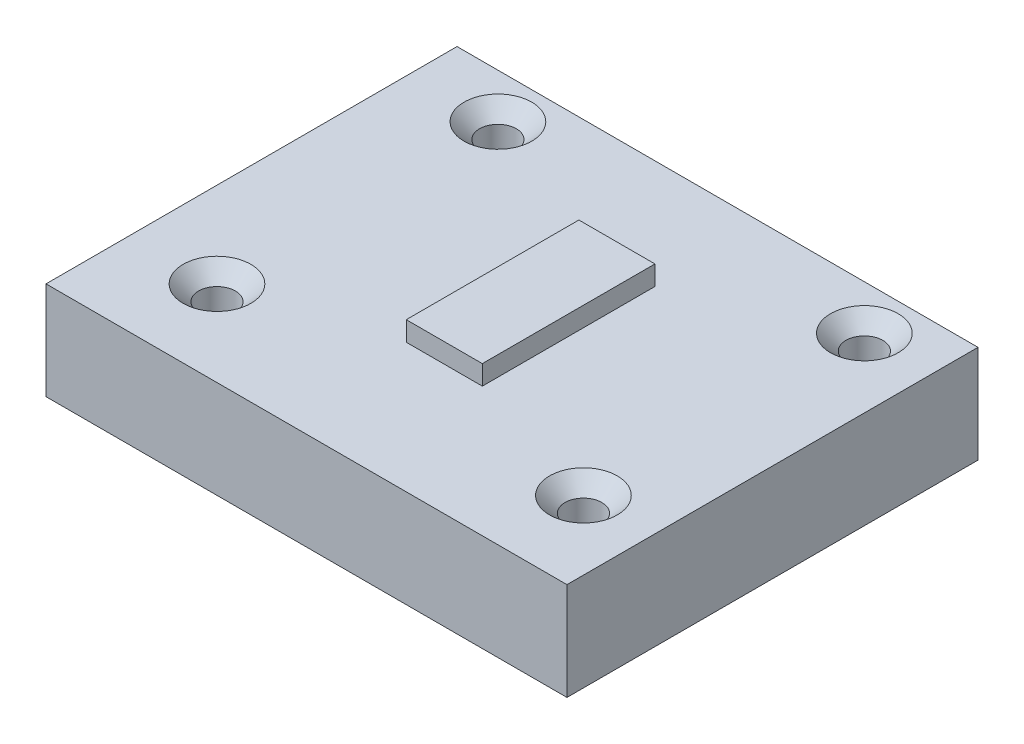
from build123d import *

# Parameters (mm, degrees)
SKETCH1_W                                       = 203.2
SKETCH1_H                                       = 107.15625
BOSS_EXTRUDE1_DEPTH                             = 6.35
CSK_FOR_M2_FLAT_HEAD_MACHINE_SCREW1_D           = 2.4
CSK_FOR_M2_FLAT_HEAD_MACHINE_SCREW1_CSINK_D     = 4.4
CSK_FOR_M2_FLAT_HEAD_MACHINE_SCREW1_CSINK_ANGLE = 90
SKETCH4_W                                       = 4.943628295
SKETCH4_H                                       = 11.218233438
BOSS_EXTRUDE2_DEPTH                             = 1.27
SKETCH5_R                                       = 2.2
SKETCH5_W                                       = 33.85522898
SKETCH5_H                                       = 80.444626197
CUT_EXTRUDE1_DEPTH                              = 230.810844857


with BuildPart() as part:
    # Sketch1 → Boss-Extrude1 (new body)
    with BuildSketch(Plane(origin=(0, 0, 0), x_dir=(1, 0, 0), z_dir=(0, 1, 0))):
        with Locations((101.6, 53.578125)):
            Rectangle(SKETCH1_W, SKETCH1_H)
    extrude(amount=BOSS_EXTRUDE1_DEPTH)

    # CSK for M2 Flat Head Machine Screw1 (through all)
    with Locations(Plane(origin=(0, 6.35, 0), x_dir=(1, 0, 0), z_dir=(0, 1, 0))):
        with Locations((5.55625, 101.6), (1.201469153, 116.400099152), (1.201469153, 113.370035287), (29.36875, 101.6), (5.55625, 5.55625), (29.36875, 5.55625), (173.83125, 5.55625), (173.83125, 101.6), (197.64375, 101.6), (197.64375, 5.55625), (5.55625, 83.34375), (29.36875, 83.34375), (5.55625, 23.8125), (173.83125, 83.34375), (197.64375, 83.34375), (173.83125, 23.8125), (197.64375, 23.8125), (29.36875, 23.8125)):
            CounterSinkHole(CSK_FOR_M2_FLAT_HEAD_MACHINE_SCREW1_D / 2, CSK_FOR_M2_FLAT_HEAD_MACHINE_SCREW1_CSINK_D / 2, counter_sink_angle=CSK_FOR_M2_FLAT_HEAD_MACHINE_SCREW1_CSINK_ANGLE)

    # Sketch4 → Boss-Extrude2 (add)
    with BuildSketch(Plane(origin=(0, 6.35, 0), x_dir=(1, 0, 0), z_dir=(0, 1, 0))):
        with Locations((17.463249219, 14.029098644)):
            Rectangle(SKETCH4_W, SKETCH4_H)
    extrude(amount=BOSS_EXTRUDE2_DEPTH)

    # Sketch5 → Cut-Extrude1 (cut, through all)
    # profile 1 of 14: a face of its own
    with BuildSketch(Plane(origin=(0, 6.35, 0), x_dir=(1, 0, 0), z_dir=(0, 1, 0))):
        Polygon((203.2, 107.15625), (33.85522898, 107.15625), (33.85522898, 26.711623803), (33.85522898, 0), (203.2, 0), align=None)
        with Locations((173.83125, 5.55625)):
            Circle(SKETCH5_R, mode=Mode.SUBTRACT)
        with Locations((197.64375, 5.55625)):
            Circle(SKETCH5_R, mode=Mode.SUBTRACT)
        with Locations((173.83125, 23.8125)):
            Circle(SKETCH5_R, mode=Mode.SUBTRACT)
        with Locations((197.64375, 23.8125)):
            Circle(SKETCH5_R, mode=Mode.SUBTRACT)
        with Locations((173.83125, 83.34375)):
            Circle(SKETCH5_R, mode=Mode.SUBTRACT)
        with Locations((197.64375, 83.34375)):
            Circle(SKETCH5_R, mode=Mode.SUBTRACT)
        with Locations((173.83125, 101.6)):
            Circle(SKETCH5_R, mode=Mode.SUBTRACT)
        with Locations((197.64375, 101.6)):
            Circle(SKETCH5_R, mode=Mode.SUBTRACT)
    # profile 2 of 14: a face of its own
    with BuildSketch(Plane(origin=(0, 6.35, 0), x_dir=(1, 0, 0), z_dir=(0, 1, 0))):
        with Locations((16.92761449, 66.933936902)):
            Rectangle(SKETCH5_W, SKETCH5_H)
        with Locations((5.55625, 83.34375)):
            Circle(SKETCH5_R, mode=Mode.SUBTRACT)
        with Locations((29.36875, 83.34375)):
            Circle(SKETCH5_R, mode=Mode.SUBTRACT)
        with Locations((5.55625, 101.6)):
            Circle(SKETCH5_R, mode=Mode.SUBTRACT)
        with Locations((29.36875, 101.6)):
            Circle(SKETCH5_R, mode=Mode.SUBTRACT)
    # profile 3 of 14: a face of its own
    with BuildSketch(Plane(origin=(0, 6.35, 0), x_dir=(1, 0, 0), z_dir=(0, 1, 0))):
        with Locations((5.55625, 83.34375)):
            Circle(SKETCH5_R)
    # profile 4 of 14: a face of its own
    with BuildSketch(Plane(origin=(0, 6.35, 0), x_dir=(1, 0, 0), z_dir=(0, 1, 0))):
        with Locations((5.55625, 101.6)):
            Circle(SKETCH5_R)
    # profile 5 of 14: a face of its own
    with BuildSketch(Plane(origin=(0, 6.35, 0), x_dir=(1, 0, 0), z_dir=(0, 1, 0))):
        with Locations((29.36875, 101.6)):
            Circle(SKETCH5_R)
    # profile 6 of 14: a face of its own
    with BuildSketch(Plane(origin=(0, 6.35, 0), x_dir=(1, 0, 0), z_dir=(0, 1, 0))):
        with Locations((29.36875, 83.34375)):
            Circle(SKETCH5_R)
    # profile 7 of 14: a face of its own
    with BuildSketch(Plane(origin=(0, 6.35, 0), x_dir=(1, 0, 0), z_dir=(0, 1, 0))):
        with Locations((173.83125, 101.6)):
            Circle(SKETCH5_R)
    # profile 8 of 14: a face of its own
    with BuildSketch(Plane(origin=(0, 6.35, 0), x_dir=(1, 0, 0), z_dir=(0, 1, 0))):
        with Locations((197.64375, 101.6)):
            Circle(SKETCH5_R)
    # profile 9 of 14: a face of its own
    with BuildSketch(Plane(origin=(0, 6.35, 0), x_dir=(1, 0, 0), z_dir=(0, 1, 0))):
        with Locations((173.83125, 83.34375)):
            Circle(SKETCH5_R)
    # profile 10 of 14: a face of its own
    with BuildSketch(Plane(origin=(0, 6.35, 0), x_dir=(1, 0, 0), z_dir=(0, 1, 0))):
        with Locations((197.64375, 83.34375)):
            Circle(SKETCH5_R)
    # profile 11 of 14: a face of its own
    with BuildSketch(Plane(origin=(0, 6.35, 0), x_dir=(1, 0, 0), z_dir=(0, 1, 0))):
        with Locations((173.83125, 23.8125)):
            Circle(SKETCH5_R)
    # profile 12 of 14: a face of its own
    with BuildSketch(Plane(origin=(0, 6.35, 0), x_dir=(1, 0, 0), z_dir=(0, 1, 0))):
        with Locations((197.64375, 23.8125)):
            Circle(SKETCH5_R)
    # profile 13 of 14: a face of its own
    with BuildSketch(Plane(origin=(0, 6.35, 0), x_dir=(1, 0, 0), z_dir=(0, 1, 0))):
        with Locations((173.83125, 5.55625)):
            Circle(SKETCH5_R)
    # profile 14 of 14: a face of its own
    with BuildSketch(Plane(origin=(0, 6.35, 0), x_dir=(1, 0, 0), z_dir=(0, 1, 0))):
        with Locations((197.64375, 5.55625)):
            Circle(SKETCH5_R)
    extrude(amount=-CUT_EXTRUDE1_DEPTH, mode=Mode.SUBTRACT)


solid = part.part
